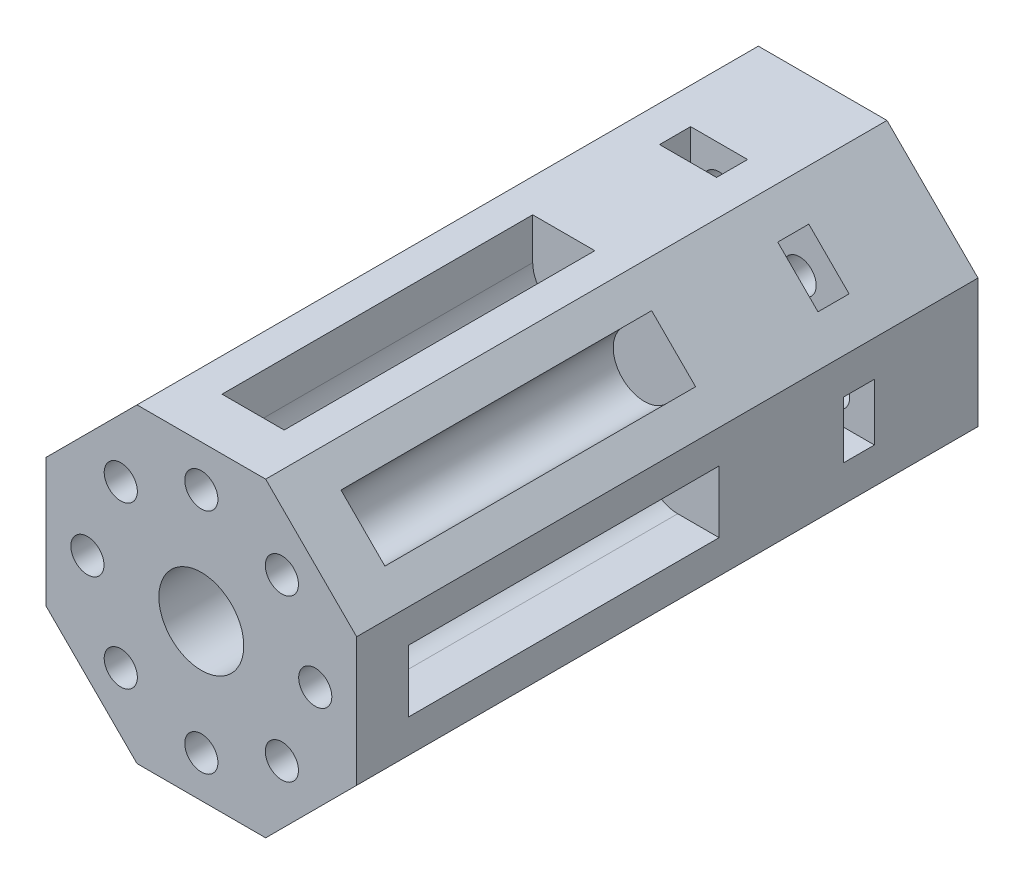
from build123d import *

# Parameters (mm, degrees)
SALIENTE_EXTRUIR1_DEPTH = 60
CROQUIS2_R              = 1.6
CORTAR_EXTRUIR1_DEPTH   = 20
CORTAR_EXTRUIR2_START   = -10
CORTAR_EXTRUIR2_DEPTH   = 3
CROQUIS4_R              = 4.1
CORTAR_EXTRUIR3_DEPTH   = 64.639610307
CORTAR_EXTRUIR4_START   = -10
CROQUIS6_R              = 1.6
CORTAR_EXTRUIR4_DEPTH   = 10
CORTAR_EXTRUIR5_START   = -5
CORTAR_EXTRUIR5_DEPTH   = 30


with BuildPart() as part:
    # Croquis1 → Saliente-Extruir1 (new body)
    with BuildSketch(Plane.XY):
        Polygon((15, -6.213203436), (15, 6.213203436), (6.213203436, 15), (-6.213203436, 15), (-15, 6.213203436), (-15, -6.213203436), (-6.213203436, -15), (6.213203436, -15), align=None)
    extrude(amount=SALIENTE_EXTRUIR1_DEPTH)

    # Croquis2 → Cortar-Extruir1 (cut)
    with BuildSketch(Plane(origin=(0, 0, 0), x_dir=(-1, 0, 0), z_dir=(0, 0, -1))):
        with Locations((0, 11)):
            Circle(CROQUIS2_R)
        with Locations((7.778174593, 7.778174593)):
            Circle(CROQUIS2_R)
        with Locations((11, 0)):
            Circle(CROQUIS2_R)
        with Locations((7.778174593, -7.778174593)):
            Circle(CROQUIS2_R)
        with Locations((0, -11)):
            Circle(CROQUIS2_R)
        with Locations((-7.778174593, -7.778174593)):
            Circle(CROQUIS2_R)
        with Locations((-11, 0)):
            Circle(CROQUIS2_R)
        with Locations((-7.778174593, 7.778174593)):
            Circle(CROQUIS2_R)
    extrude(amount=-CORTAR_EXTRUIR1_DEPTH, mode=Mode.SUBTRACT)

    # Croquis3 → Cortar-Extruir2 (cut)
    with BuildSketch(Plane(origin=(0, 0, 0), x_dir=(-1, 0, 0), z_dir=(0, 0, -1)).offset(CORTAR_EXTRUIR2_START)):
        Polygon((-2.75, 12.58771324), (-2.75, 18.463203436), (2.75, 23.963203436), (2.75, 12.58771324), (2.75, 9.41228676), (0, 7.824573519), (-2.75, 9.41228676), align=None)
        Polygon((6.956313744, 10.84540104), (11.110912703, 15), (18.889087297, 15), (10.84540104, 6.956313744), (8.600035443, 4.710948146), (5.532808996, 5.532808996), (4.710948146, 8.600035443), align=None)
        Polygon((12.58771324, 2.75), (18.463203436, 2.75), (23.963203436, -2.75), (12.58771324, -2.75), (9.41228676, -2.75), (7.824573519, 0), (9.41228676, 2.75), align=None)
        Polygon((10.84540104, -6.956313744), (15, -11.110912703), (15, -18.889087297), (6.956313744, -10.84540104), (4.710948146, -8.600035443), (5.532808996, -5.532808996), (8.600035443, -4.710948146), align=None)
        Polygon((2.75, -12.58771324), (2.75, -18.463203436), (-2.75, -23.963203436), (-2.75, -12.58771324), (-2.75, -9.41228676), (0, -7.824573519), (2.75, -9.41228676), align=None)
        Polygon((-6.956313744, -10.84540104), (-11.110912703, -15), (-18.889087297, -15), (-10.84540104, -6.956313744), (-8.600035443, -4.710948146), (-5.532808995, -5.532808996), (-4.710948146, -8.600035443), align=None)
        Polygon((-12.58771324, -2.75), (-18.463203436, -2.75), (-23.963203436, 2.75), (-12.58771324, 2.75), (-9.41228676, 2.75), (-7.824573519, 0), (-9.41228676, -2.75), align=None)
        Polygon((-10.84540104, 6.956313744), (-15, 11.110912703), (-15, 18.889087297), (-6.956313744, 10.84540104), (-4.710948146, 8.600035443), (-5.532808996, 5.532808996), (-8.600035443, 4.710948146), align=None)
    extrude(amount=-CORTAR_EXTRUIR2_DEPTH, mode=Mode.SUBTRACT)

    # Croquis4 → Cortar-Extruir3 (cut, through all)
    with BuildSketch(Plane(origin=(0, 0, 0), x_dir=(-1, 0, 0), z_dir=(0, 0, -1))):
        Circle(CROQUIS4_R)
    extrude(amount=-CORTAR_EXTRUIR3_DEPTH, mode=Mode.SUBTRACT)

    # Croquis6 → Cortar-Extruir4 (cut)
    with BuildSketch(Plane.XY.offset(60).offset(CORTAR_EXTRUIR4_START)):
        with Locations(Location((0, 11, 0), (0, 0, 180))):
            Circle(CROQUIS6_R)
        with Locations(Location((7.778174593, 7.778174593, 0), (0, 0, 180))):
            Circle(CROQUIS6_R)
        with Locations(Location((11, 0, 0), (0, 0, 180))):
            Circle(CROQUIS6_R)
        with Locations(Location((7.778174593, -7.778174593, 0), (0, 0, 180))):
            Circle(CROQUIS6_R)
        with Locations(Location((0, -11, 0), (0, 0, 180))):
            Circle(CROQUIS6_R)
        with Locations(Location((-7.778174593, -7.778174593, 0), (0, 0, 180))):
            Circle(CROQUIS6_R)
        with Locations(Location((-11, 0, 0), (0, 0, 180))):
            Circle(CROQUIS6_R)
        with Locations(Location((-7.778174593, 7.778174593, 0), (0, 0, 180))):
            Circle(CROQUIS6_R)
    extrude(amount=CORTAR_EXTRUIR4_DEPTH, mode=Mode.SUBTRACT)

    # Croquis7 → Cortar-Extruir5 (cut)
    with BuildSketch(Plane.XY.offset(60).offset(CORTAR_EXTRUIR5_START)):
        with BuildLine():
            Line((-3, 11), (-3, 15))
            Line((-3, 15), (3, 15))
            Line((3, 15), (3, 11))
            ThreePointArc((3, 11), (0, 8), (-3, 11))
        make_face()
        with BuildLine():
            Line((5.656854249, 9.899494937), (8.485281374, 12.727922061))
            Line((8.485281374, 12.727922061), (12.727922061, 8.485281374))
            Line((12.727922061, 8.485281374), (9.899494937, 5.656854249))
            ThreePointArc((9.899494937, 5.656854249), (5.656854249, 5.656854249), (5.656854249, 9.899494937))
        make_face()
        with BuildLine():
            Line((11, 3), (15, 3))
            Line((15, 3), (15, -3))
            Line((15, -3), (11, -3))
            ThreePointArc((11, -3), (8, 0), (11, 3))
        make_face()
        with BuildLine():
            Line((9.899494937, -5.656854249), (12.727922061, -8.485281374))
            Line((12.727922061, -8.485281374), (8.485281374, -12.727922061))
            Line((8.485281374, -12.727922061), (5.656854249, -9.899494937))
            ThreePointArc((5.656854249, -9.899494937), (5.656854249, -5.656854249), (9.899494937, -5.656854249))
        make_face()
        with BuildLine():
            Line((3, -11), (3, -15))
            Line((3, -15), (-3, -15))
            Line((-3, -15), (-3, -11))
            ThreePointArc((-3, -11), (0, -8), (3, -11))
        make_face()
        with BuildLine():
            Line((-5.656854249, -9.899494937), (-8.485281374, -12.727922061))
            Line((-8.485281374, -12.727922061), (-12.727922061, -8.485281374))
            Line((-12.727922061, -8.485281374), (-9.899494937, -5.656854249))
            ThreePointArc((-9.899494937, -5.656854249), (-5.656854249, -5.656854249), (-5.656854249, -9.899494937))
        make_face()
        with BuildLine():
            Line((-11, -3), (-15, -3))
            Line((-15, -3), (-15, 3))
            Line((-15, 3), (-11, 3))
            ThreePointArc((-11, 3), (-8, 0), (-11, -3))
        make_face()
        with BuildLine():
            Line((-9.899494937, 5.656854249), (-12.727922061, 8.485281374))
            Line((-12.727922061, 8.485281374), (-8.485281374, 12.727922061))
            Line((-8.485281374, 12.727922061), (-5.656854249, 9.899494937))
            ThreePointArc((-5.656854249, 9.899494937), (-5.656854249, 5.656854249), (-9.899494937, 5.656854249))
        make_face()
    extrude(amount=-CORTAR_EXTRUIR5_DEPTH, mode=Mode.SUBTRACT)


solid = part.part
